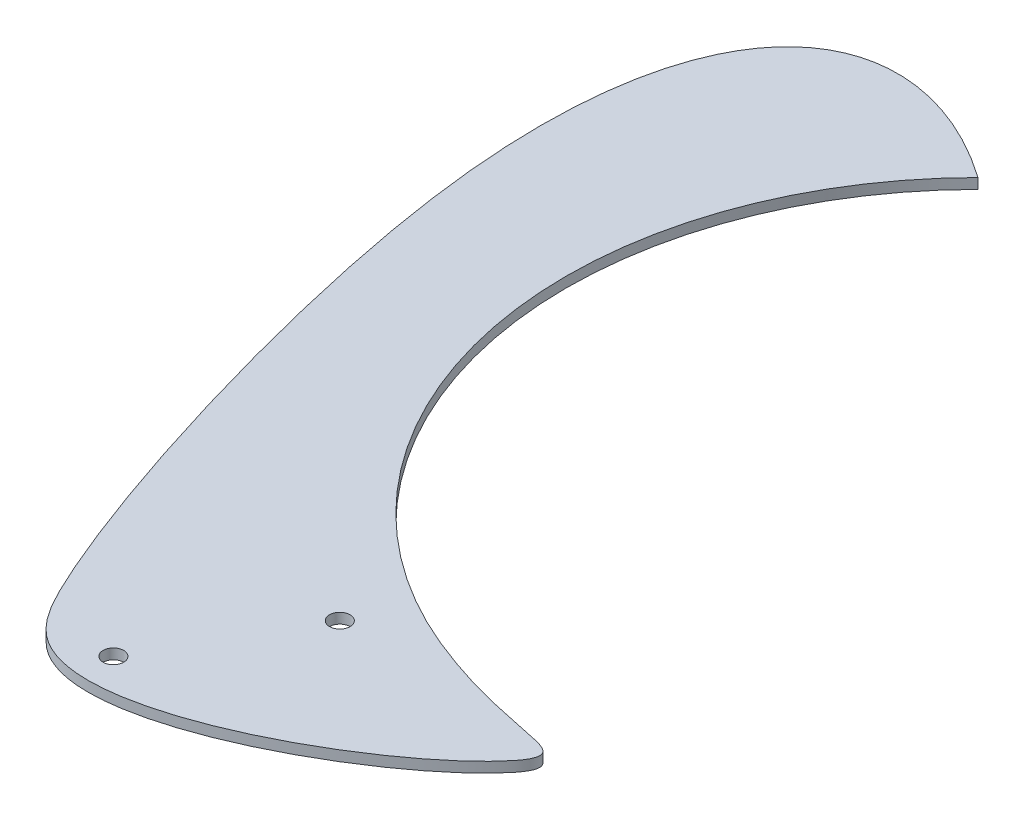
from build123d import *

# Parameters (mm, degrees)
SKETCH1_R           = 6.35
BOSS_EXTRUDE1_DEPTH = 6.35


with BuildPart() as part:
    # Sketch1 → Boss-Extrude1 (new body)
    with BuildSketch(Plane(origin=(0, 0, 0), x_dir=(1, 0, 0), z_dir=(0, 1, 0))):
        with BuildLine():
            ThreePointArc((-179.605122421, 179.605122421), (-249.119461222, -49.552941792), (-97.201591821, -234.665401258))
            add(Edge.make_bspline(
                [(-179.605122421, 179.605122421), (-280.573661094, 250.548217173), (-407.979972417, 177.890725525), (-268.823888221, -278.270507313), (-199.545548533, -402.86770968), (-35.257440084, -312.81324434), (4.032264641, -253.353262904), (-44.074738001, -256.519593289), (-97.201591821, -234.665401258)],
                knots=[0, 0, 0, 0, 0.421502514, 0.634964603, 0.685831791, 0.903025221, 0.937156959, 1, 1, 1, 1], degree=3))
        make_face()
        with Locations(Location((-139.7, -254.05848829, 0), (0, 0, 270))):
            Circle(SKETCH1_R, mode=Mode.SUBTRACT)
        with Locations(Location((-190.5, -342.95848829, 0), (0, 0, 270))):
            Circle(SKETCH1_R, mode=Mode.SUBTRACT)
    extrude(amount=BOSS_EXTRUDE1_DEPTH)


solid = part.part
